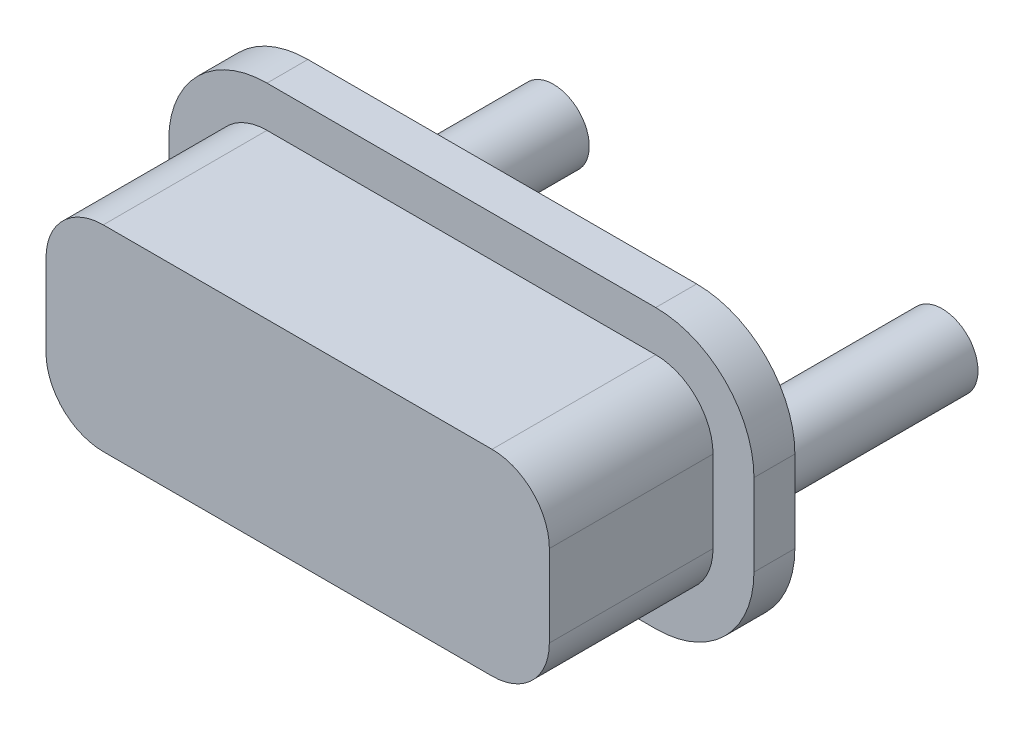
from build123d import *

# Parameters (mm, degrees)
BOSS_EXTRUDE1_DEPTH = 10
BOSS_EXTRUDE2_START = -10
BOSS_EXTRUDE2_DEPTH = 2
BOSS_EXTRUDE3_START = -22
SKETCH3_R           = 1.75
BOSS_EXTRUDE3_DEPTH = 12
CHAMFER1_SIZE       = 1


with BuildPart() as part:
    # Sketch1 → Boss-Extrude1 (new body)
    with BuildSketch(Plane.XY):
        with BuildLine():
            Line((12.3, 57.365), (12.3, 61.365))
            ThreePointArc((12.3, 61.365), (11.479898987, 63.344898987), (9.5, 64.165))
            Line((9.5, 64.165), (-9.5, 64.165))
            ThreePointArc((-9.5, 64.165), (-11.479898987, 63.344898987), (-12.3, 61.365))
            Line((-12.3, 61.365), (-12.3, 57.365))
            ThreePointArc((-12.3, 57.365), (-11.479898987, 55.385101013), (-9.5, 54.565))
            Line((-9.5, 54.565), (9.5, 54.565))
            ThreePointArc((9.5, 54.565), (11.479898987, 55.385101013), (12.3, 57.365))
        make_face()
    extrude(amount=-BOSS_EXTRUDE1_DEPTH)

    # Sketch2 → Boss-Extrude2 (add)
    with BuildSketch(Plane.XY.offset(BOSS_EXTRUDE2_START)):
        with BuildLine():
            Line((14.3, 57.365), (14.3, 61.365))
            ThreePointArc((14.3, 61.365), (12.89411255, 64.75911255), (9.5, 66.165))
            Line((9.5, 66.165), (-9.5, 66.165))
            ThreePointArc((-9.5, 66.165), (-12.89411255, 64.75911255), (-14.3, 61.365))
            Line((-14.3, 61.365), (-14.3, 57.365))
            ThreePointArc((-14.3, 57.365), (-12.89411255, 53.97088745), (-9.5, 52.565))
            Line((-9.5, 52.565), (9.5, 52.565))
            ThreePointArc((9.5, 52.565), (12.89411255, 53.97088745), (14.3, 57.365))
        make_face()
    extrude(amount=BOSS_EXTRUDE2_DEPTH)

    # Sketch3 → Boss-Extrude3 (add)
    with BuildSketch(Plane.XY.offset(BOSS_EXTRUDE3_START)):
        with Locations((9.5, 57.365)):
            Circle(SKETCH3_R)
        with Locations((-9.5, 57.365)):
            Circle(SKETCH3_R)
    extrude(amount=BOSS_EXTRUDE3_DEPTH)

    # Chamfer1
    chamfer1_edges = [part.edges().sort_by_distance(p)[0] for p in [
        (7.75, 57.365, -10),
        (-11.25, 57.365, -10),
    ]]
    chamfer(chamfer1_edges, length=CHAMFER1_SIZE)


solid = part.part
